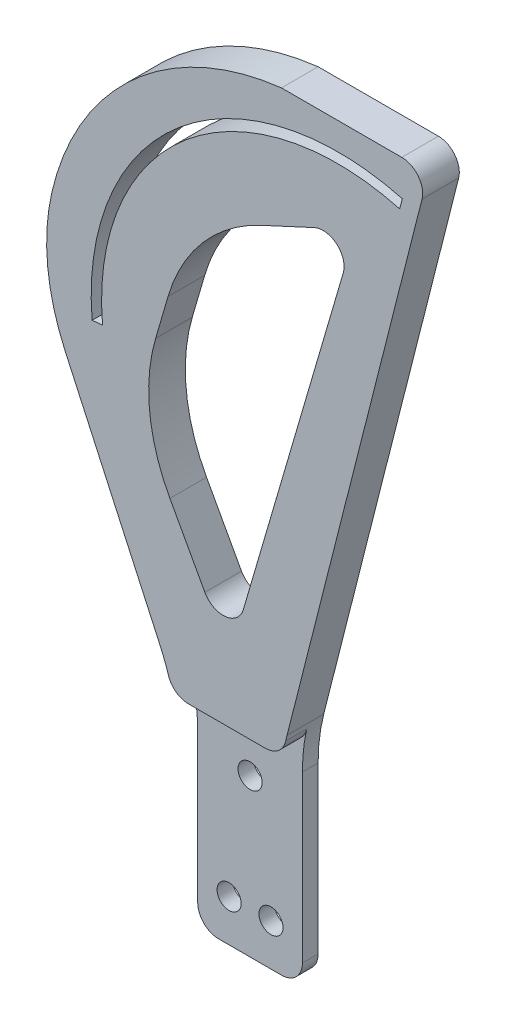
from build123d import *

# Parameters (mm, degrees)
SKETCH1_R          = 2.3
EXTRUDE1_DEPTH     = 7
FILLET1_R          = 39
FILLET2_R          = 33
FILLET3_R          = 4
FILLET4_R          = 35
SKETCH2_W          = 32.945688526
SKETCH2_H          = 40
CUT_EXTRUDE1_DEPTH = 4
FILLET5_R          = 4


with BuildPart() as part:
    # Sketch1 → Extrude1 (new body)
    with BuildSketch(Plane.XY):
        with BuildLine():
            Line((-10, 0), (-10, 40))
            Line((-10, 40), (-34.835050164, 94.26528975))
            ThreePointArc((-34.835050164, 94.26528975), (-24.125651083, 131.816849255), (10, 150.797122912))
            Line((10, 150.797122912), (38.123036173, 150.797122912))
            Line((38.123036173, 150.797122912), (10, 40))
            Line((10, 40), (10, 0))
            Line((10, 0), (-10, 0))
        make_face()
        with Locations((0, 30)):
            Circle(SKETCH1_R, mode=Mode.SUBTRACT)
        with Locations((4, 8)):
            Circle(SKETCH1_R, mode=Mode.SUBTRACT)
        with Locations((-4, 8)):
            Circle(SKETCH1_R, mode=Mode.SUBTRACT)
        Polygon((24.273596224, 134.519949949), (0, 51.555620572), (-17.877283618, 84.220450394), (-7.457593377, 119.833740044), align=None, mode=Mode.SUBTRACT)
        with BuildLine():
            Line((32.581459881, 142.069152681), (33.097875117, 144.001331581))
            ThreePointArc((33.097875117, 144.001331581), (-9.474149394, 134.549204992), (-26.175231417, 94.26528975))
            Line((-26.175231417, 94.26528975), (-24.182732091, 94.438340134))
            ThreePointArc((-24.182732091, 94.438340134), (-8.246919268, 133.086649081), (32.581459881, 142.069152681))
        make_face(mode=Mode.SUBTRACT)
    extrude(amount=EXTRUDE1_DEPTH)

    # Fillet1
    fillet1_edges = [part.edges().sort_by_distance(p)[0] for p in [
        (-34.835050164, 94.26528975, 3.5),
    ]]
    fillet(fillet1_edges, radius=FILLET1_R)

    # Fillet2
    fillet2_edges = [part.edges().sort_by_distance(p)[0] for p in [
        (-7.457593377, 119.833740044, 3.5),
        (-17.877283618, 84.220450394, 3.5),
    ]]
    fillet(fillet2_edges, radius=FILLET2_R)

    # Fillet3
    fillet3_edges = [part.edges().sort_by_distance(p)[0] for p in [
        (10, 0, 3.5),
        (-10, 0, 3.5),
        (38.123036173, 150.797122912, 3.5),
        (24.273596224, 134.519949949, 3.5),
        (0, 51.555620572, 3.5),
    ]]
    fillet(fillet3_edges, radius=FILLET3_R)

    # Fillet4
    fillet4_edges = [part.edges().sort_by_distance(p)[0] for p in [
        (-10, 40, 3.5),
        (10, 40, 3.5),
    ]]
    fillet(fillet4_edges, radius=FILLET4_R)

    # Sketch2 → Cut-Extrude1 (cut)
    with BuildSketch(Plane.XY.offset(7)):
        with Locations((-0.117072908, 20)):
            Rectangle(SKETCH2_W, SKETCH2_H)
    extrude(amount=-CUT_EXTRUDE1_DEPTH, mode=Mode.SUBTRACT)

    # Fillet5
    fillet5_edges = [part.edges().sort_by_distance(p)[0] for p in [
        (10.274211948, 40, 5),
        (-10.841473657, 40, 5),
    ]]
    fillet(fillet5_edges, radius=FILLET5_R)


solid = part.part
